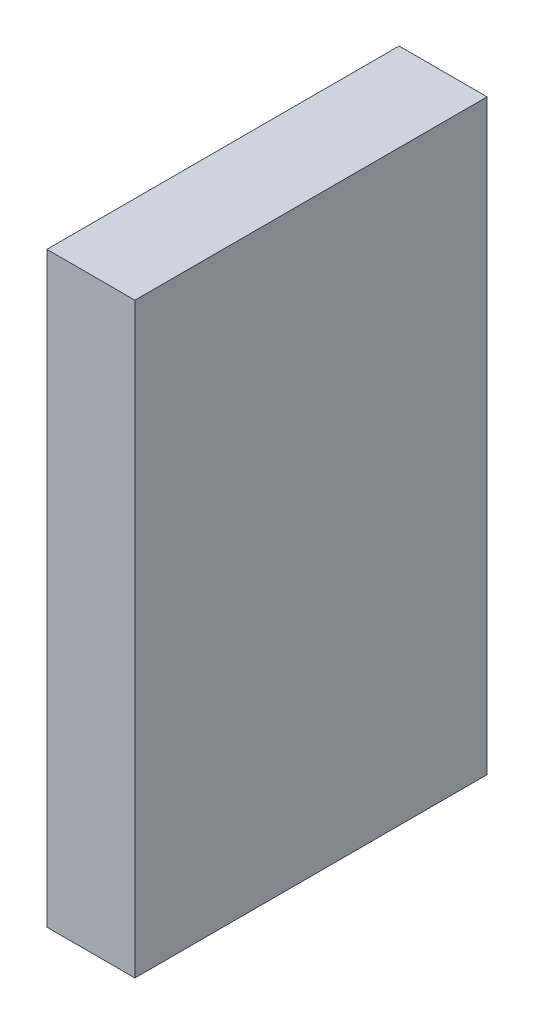
from build123d import *

# Parameters (mm, degrees)
SKETCH1_W      = 15
SKETCH1_H      = 100
EXTRUDE1_DEPTH = 60


with BuildPart() as part:
    # Sketch1 → Extrude1 (new body)
    with BuildSketch(Plane.XY):
        with Locations((7.5, 50)):
            Rectangle(SKETCH1_W, SKETCH1_H)
    extrude(amount=EXTRUDE1_DEPTH)


solid = part.part
